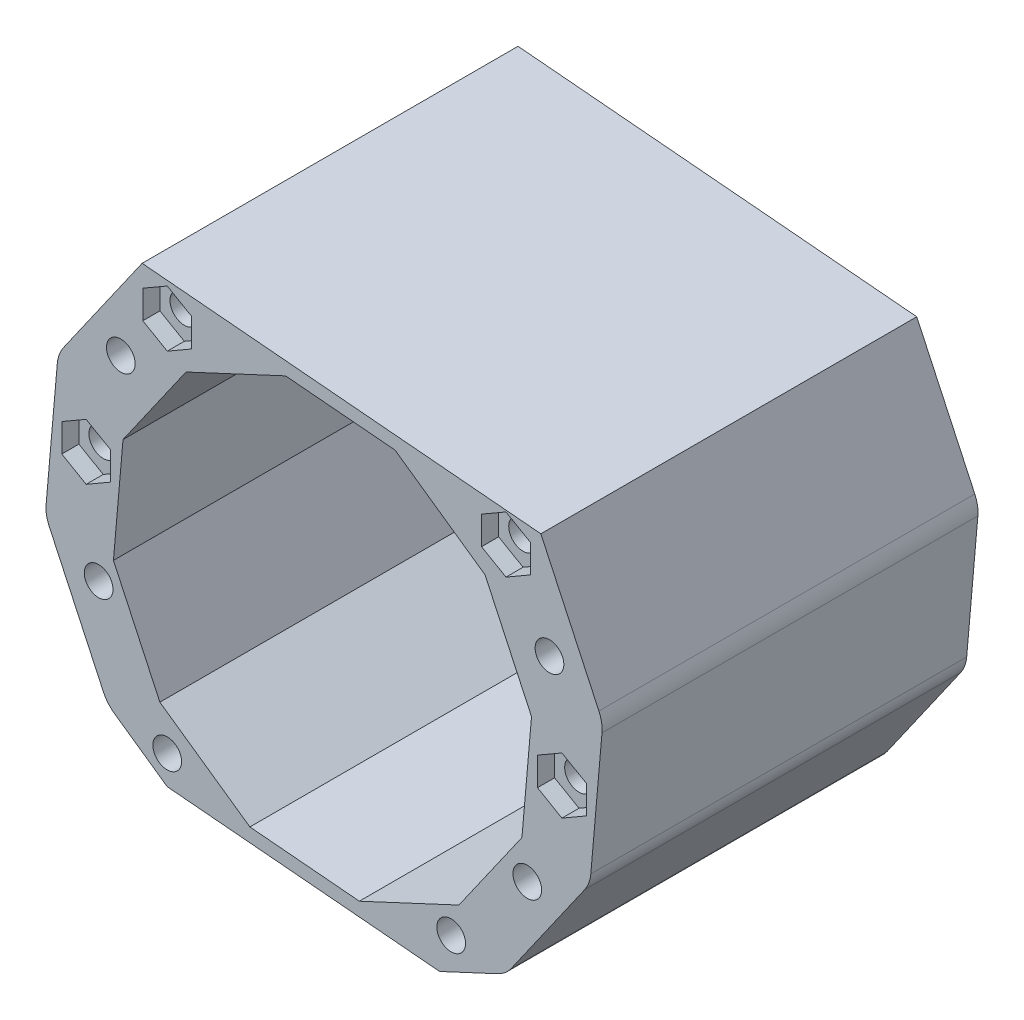
from build123d import *

# Parameters (mm, degrees)
BOSS_EXTRU_1_DEPTH      = 10
ESQUISSE2_R             = 2.1
BOSS_EXTRU_2_DEPTH      = 45
ENL_V_MAT_EXTRU_1_DEPTH = 2.5
CONG_1_R                = 5


with BuildPart() as part:
    # Esquisse1 → Boss.-Extru.1 (new body)
    with BuildSketch(Plane.XY):
        Polygon((16.90473047, -36.252311481), (26.618508055, -31.722702604), (38.913655488, -14.163412304), (40.781920359, 7.190952884), (31.722702604, 26.618508055), (-26.618508055, 31.722702604), (-38.913655488, 14.163412304), (-40.781920359, -7.190952884), (-31.722702604, -26.618508055), (-22.943057454, -32.766081772), align=None)
    extrude(amount=BOSS_EXTRU_1_DEPTH)

    # Esquisse2 → Boss.-Extru.2 (add)
    with BuildSketch(Plane.XY.offset(10)):
        Polygon((31.722702604, 26.618508055), (-26.618508055, 31.722702604), (-38.913655488, 14.163412304), (-40.781920359, -7.190952884), (-31.722702604, -26.618508055), (-22.943057454, -32.766081772), (16.90473047, -36.252311481), (26.618508055, -31.722702604), (38.913655488, -14.163412304), (40.781920359, 7.190952884), align=None)
        with Locations(Location((34.806654387, -3.73808347, 0), (0, 0, 180))):
            Circle(ESQUISSE2_R, mode=Mode.SUBTRACT)
        with Locations(Location((29.737818366, -18.469938184, 0), (0, 0, 180))):
            Circle(ESQUISSE2_R, mode=Mode.SUBTRACT)
        with Locations(Location((-32.981605632, -11.73414452, 0), (0, 0, 180))):
            Circle(ESQUISSE2_R, mode=Mode.SUBTRACT)
        with Locations(Location((-34.806654387, 3.73808347, 0), (0, 0, 180))):
            Circle(ESQUISSE2_R, mode=Mode.SUBTRACT)
        with Locations(Location((-29.737818366, 18.469938184, 0), (0, 0, 180))):
            Circle(ESQUISSE2_R, mode=Mode.SUBTRACT)
        with Locations(Location((32.981605632, 11.73414452, 0), (0, 0, 180))):
            Circle(ESQUISSE2_R, mode=Mode.SUBTRACT)
        with Locations(Location((18.601253659, -30.822032576, 0), (0, 0, 180))):
            Circle(ESQUISSE2_R, mode=Mode.SUBTRACT)
        with Locations(Location((-22.943057454, -28.537832938, 0), (0, 0, 180))):
            Circle(ESQUISSE2_R, mode=Mode.SUBTRACT)
        with Locations(Location((26.618508055, 22.705871893, 0), (0, 0, 180))):
            Circle(ESQUISSE2_R, mode=Mode.SUBTRACT)
        with Locations(Location((-22.943057454, 26.554275329, 0), (0, 0, 180))):
            Circle(ESQUISSE2_R, mode=Mode.SUBTRACT)
        Polygon((-20.194060765, 21.161060665), (-29.41542134, 7.991592941), (-30.816619994, -8.024180951), (-24.022206677, -22.594847329), (-10.852738952, -31.816207904), (5.163034939, -33.217406557), (19.733701317, -26.42299324), (28.955061892, -13.253525516), (30.356260545, 2.762248376), (23.561847229, 17.332914754), (10.392379504, 26.554275329), (-5.623394388, 27.955473982), align=None, mode=Mode.SUBTRACT)
    extrude(amount=BOSS_EXTRU_2_DEPTH)

    # Esquisse3 → Enlèv. mat.-Extru.1 (cut)
    with BuildSketch(Plane.XY.offset(55)):
        Polygon((-34.806654387, -0.37842395), (-31.241654387, 1.67982976), (-31.241654387, 5.796337179), (-34.806654387, 7.854590889), (-38.371654387, 5.796337179), (-38.371654387, 1.67982976), align=None)
        Polygon((-22.943057454, 22.426220904), (-19.368057454, 24.490248116), (-19.368057454, 28.618302541), (-22.943057454, 30.682329753), (-26.518057454, 28.618302541), (-26.518057454, 24.490248116), align=None)
        Polygon((30.193508055, 20.641844681), (30.193508055, 24.769899106), (26.618508055, 26.833926318), (23.043508055, 24.769899106), (23.043508055, 20.641844681), (26.618508055, 18.577817469), align=None)
        Polygon((38.381654387, -5.802110682), (38.381654387, -1.674056257), (34.806654387, 0.389970955), (31.231654387, -1.674056257), (31.231654387, -5.802110682), (34.806654387, -7.866137894), align=None)
    extrude(amount=-ENL_V_MAT_EXTRU_1_DEPTH, mode=Mode.SUBTRACT)

    # Congé1
    cong_1_edges = [part.edges().sort_by_distance(p)[0] for p in [
        (40.781920359, 7.190952884, 27.5),
        (38.913655488, -14.163412304, 27.5),
        (26.618508055, -31.722702604, 27.5),
        (-31.722702604, -26.618508055, 27.5),
        (-40.781920359, -7.190952884, 27.5),
        (-38.913655488, 14.163412304, 27.5),
    ]]
    fillet(cong_1_edges, radius=CONG_1_R)


solid = part.part
